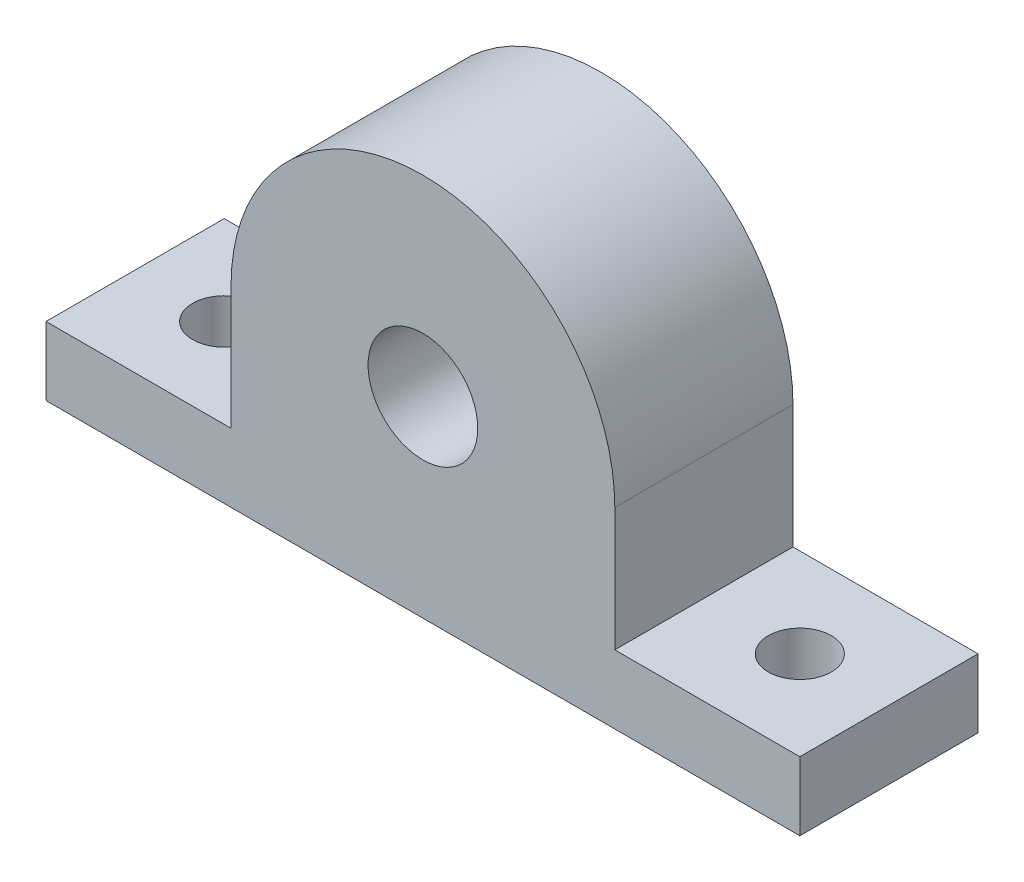
from build123d import *

# Parameters (mm, degrees)
SKETCH1_W           = 55
SKETCH1_H           = 13
BOSS_EXTRUDE1_DEPTH = 5
SKETCH2_R           = 4
BOSS_EXTRUDE2_DEPTH = 13
CUT_EXTRUDE1_REACH  = 63.016
SKETCH3_R           = 2.3


with BuildPart() as part:
    # Sketch1 → Boss-Extrude1 (new body)
    with BuildSketch(Plane(origin=(0, 0, 0), x_dir=(1, 0, 0), z_dir=(0, 1, 0))):
        with Locations((27.5, 6.5)):
            Rectangle(SKETCH1_W, SKETCH1_H)
    extrude(amount=BOSS_EXTRUDE1_DEPTH)

    # Sketch2 → Boss-Extrude2 (add)
    with BuildSketch(Plane.XY):
        with BuildLine():
            Line((13.5, 14), (13.5, 0))
            Line((13.5, 0), (41.5, 0))
            Line((41.5, 0), (41.5, 14))
            ThreePointArc((41.5, 14), (27.5, 28), (13.5, 14))
        make_face()
        with Locations((27.5, 14)):
            Circle(SKETCH2_R, mode=Mode.SUBTRACT)
    extrude(amount=-BOSS_EXTRUDE2_DEPTH)

    # Sketch3 → Cut-Extrude1 (cut, up to next)
    with BuildSketch(Plane(origin=(0, 5, 0), x_dir=(1, 0, 0), z_dir=(0, 1, 0)), mode=Mode.PRIVATE) as cut_extrude1_sk1:
        with Locations(Location((48.5, 6.5, 0), (0, 0, 270))):
            Circle(SKETCH3_R)
    cut_extrude1_tool1 = extrude(cut_extrude1_sk1.sketch, amount=-CUT_EXTRUDE1_REACH, mode=Mode.PRIVATE) & part.part
    # Sketch3 → Cut-Extrude1 (cut, up to next)
    with BuildSketch(Plane(origin=(0, 5, 0), x_dir=(1, 0, 0), z_dir=(0, 1, 0)), mode=Mode.PRIVATE) as cut_extrude1_sk2:
        with Locations(Location((6.5, 6.5, 0), (0, 0, 270))):
            Circle(SKETCH3_R)
    cut_extrude1_tool2 = extrude(cut_extrude1_sk2.sketch, amount=-CUT_EXTRUDE1_REACH, mode=Mode.PRIVATE) & part.part
    add(cut_extrude1_tool1.solids().sort_by_distance((48.5, 5, -6.5))[0], mode=Mode.SUBTRACT)
    add(cut_extrude1_tool2.solids().sort_by_distance((6.5, 5, -6.5))[0], mode=Mode.SUBTRACT)


solid = part.part
